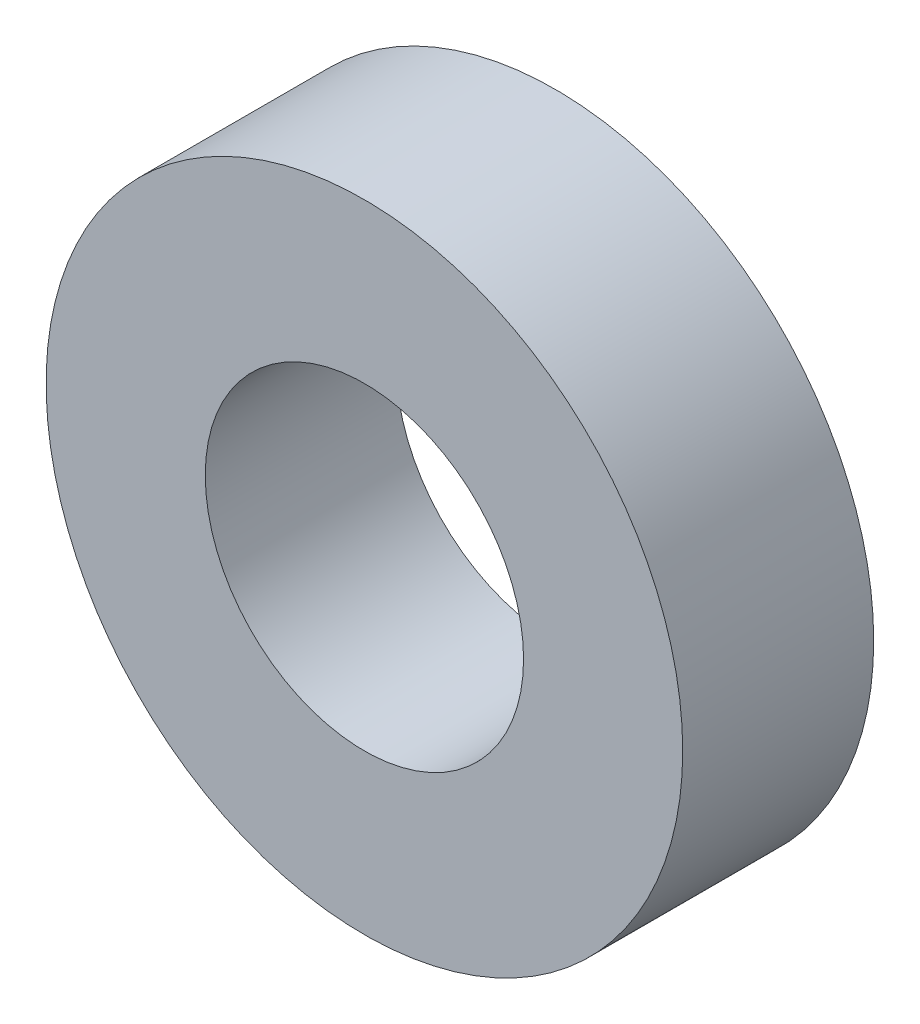
from build123d import *

# Parameters (mm, degrees)
SKETCH1_R           = 50
SKETCH1_R_2         = 25
BOSS_EXTRUDE1_DEPTH = 30


with BuildPart() as part:
    # Sketch1 → Boss-Extrude1 (new body)
    with BuildSketch(Plane.XY):
        Circle(SKETCH1_R)
        Circle(SKETCH1_R_2, mode=Mode.SUBTRACT)
    extrude(amount=BOSS_EXTRUDE1_DEPTH)


solid = part.part
